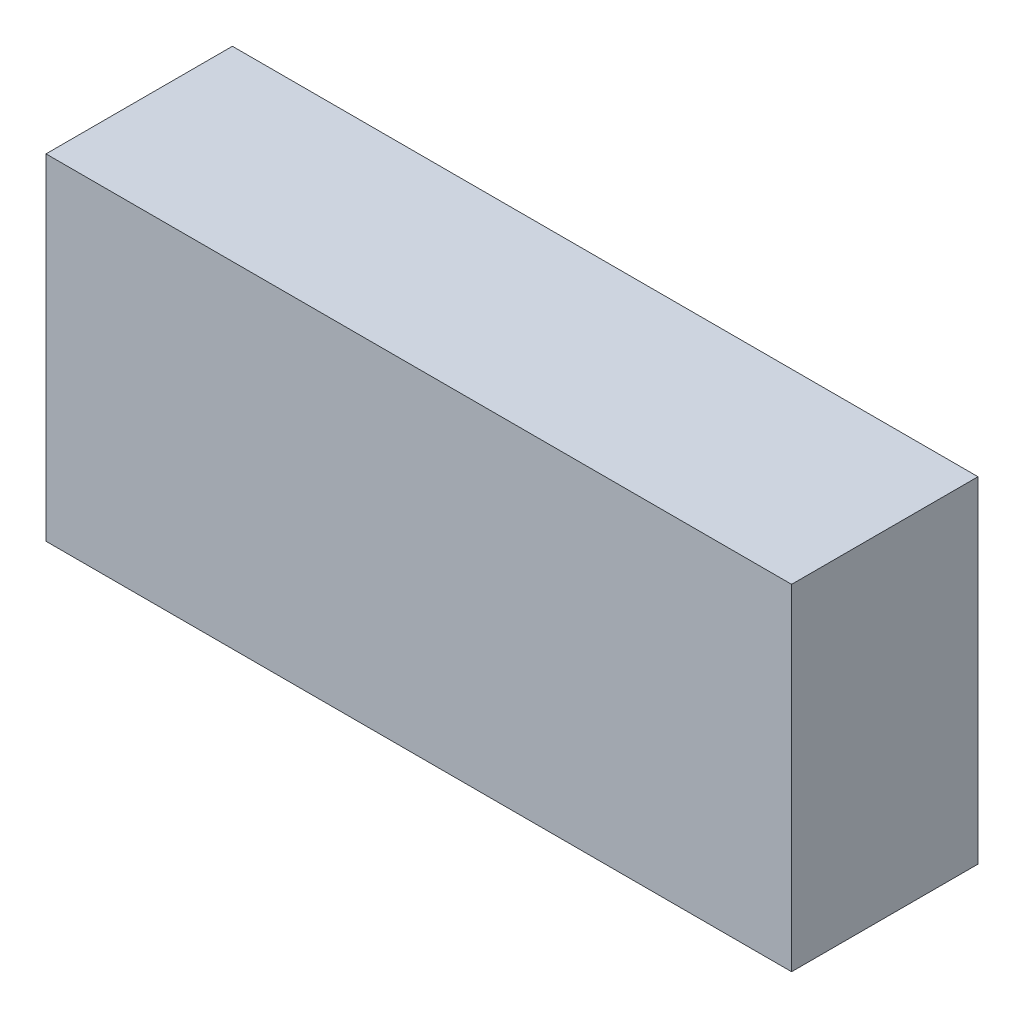
from build123d import *

# Parameters (mm, degrees)
SKETCH_1_W              = 2
SKETCH_1_H              = 0.9
COMPONENT_OUTLINE_DEPTH = 0.5


with BuildPart() as part:
    # 草图1 → Component_Outline (new body)
    with BuildSketch(Plane.XY):
        Rectangle(SKETCH_1_W, SKETCH_1_H)
    extrude(amount=COMPONENT_OUTLINE_DEPTH)


solid = part.part
